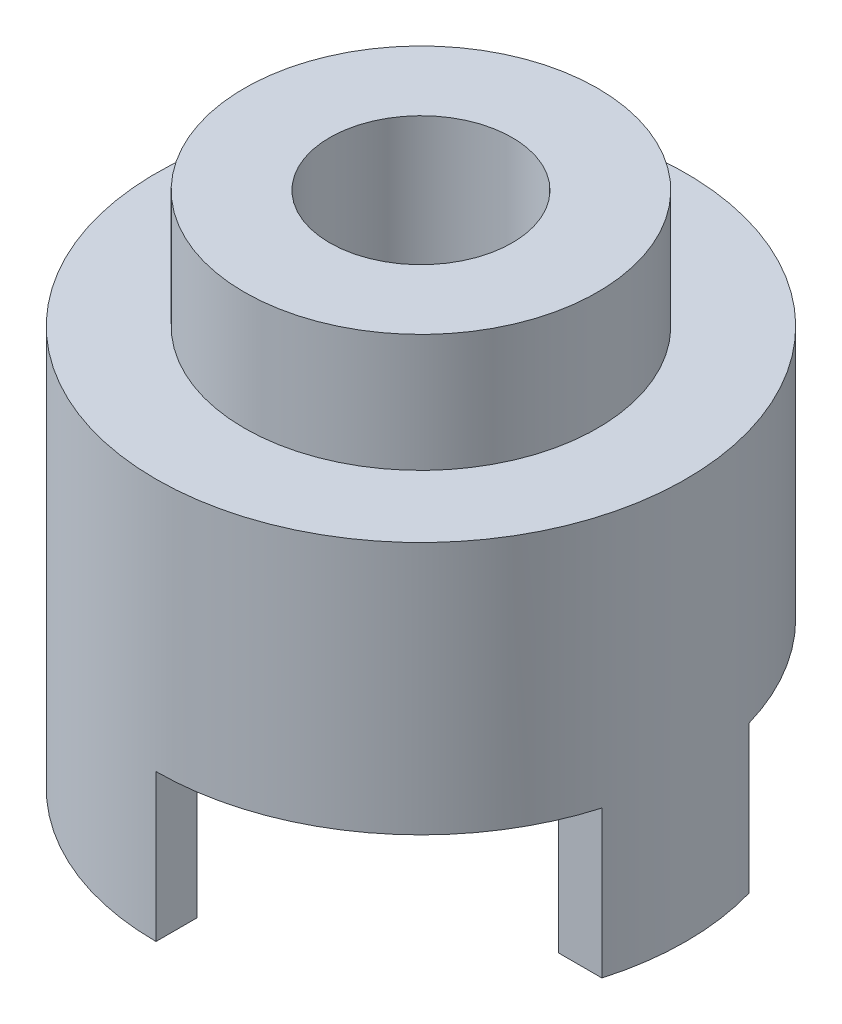
from build123d import *

# Parameters (mm, degrees)
SKETCH1_R           = 4.5
BOSS_EXTRUDE1_DEPTH = 4.3
SKETCH2_R           = 3
BOSS_EXTRUDE2_DEPTH = 2
SKETCH3_R           = 1.55
CUT_EXTRUDE1_DEPTH  = 9.954886934
BOSS_EXTRUDE3_START = 2.5
SKETCH4_R           = 4.5
SKETCH4_R_2         = 3.8
BOSS_EXTRUDE3_DEPTH = 2.5
CUT_EXTRUDE2_DEPTH  = 9.954886934


with BuildPart() as part:
    # Sketch1 → Boss-Extrude1 (new body)
    with BuildSketch(Plane(origin=(0, 0, 0), x_dir=(1, 0, 0), z_dir=(0, 1, 0))):
        with Locations(Location((0, 0, 0), (0, 0, 90))):
            Circle(SKETCH1_R)
    extrude(amount=BOSS_EXTRUDE1_DEPTH)

    # Sketch2 → Boss-Extrude2 (add)
    with BuildSketch(Plane(origin=(0, 4.3, 0), x_dir=(1, 0, 0), z_dir=(0, 1, 0))):
        with Locations(Location((0, 0, 0), (0, 0, 270))):
            Circle(SKETCH2_R)
    extrude(amount=BOSS_EXTRUDE2_DEPTH)

    # Sketch3 → Cut-Extrude1 (cut, through all)
    with BuildSketch(Plane(origin=(0, 6.3, 0), x_dir=(1, 0, 0), z_dir=(0, 1, 0))):
        with Locations(Location((0, 0, 0), (0, 0, 270))):
            Circle(SKETCH3_R)
    extrude(amount=-CUT_EXTRUDE1_DEPTH, mode=Mode.SUBTRACT)

    # Sketch4 → Boss-Extrude3 (add)
    with BuildSketch(Plane.XZ.offset(BOSS_EXTRUDE3_START)):
        with Locations(Location((0, 0, 0), (0, 0, 270))):
            Circle(SKETCH4_R)
        with Locations(Location((0, 0, 0), (0, 0, 270))):
            Circle(SKETCH4_R_2, mode=Mode.SUBTRACT)
    extrude(amount=-BOSS_EXTRUDE3_DEPTH)

    # Sketch5 → Cut-Extrude2 (cut, through all)
    with BuildSketch(Plane.XZ):
        Polygon((0, 0), (0, 5.809318517), (6.55644872, 5.809318517), (6.55644872, 1.25), (2.958025702, 1.25), (2.958025702, -1.25), (6.55644872, -1.25), (6.55644872, -5.809318517), (0, -5.809318517), align=None)
    extrude(amount=CUT_EXTRUDE2_DEPTH, mode=Mode.SUBTRACT)


solid = part.part
